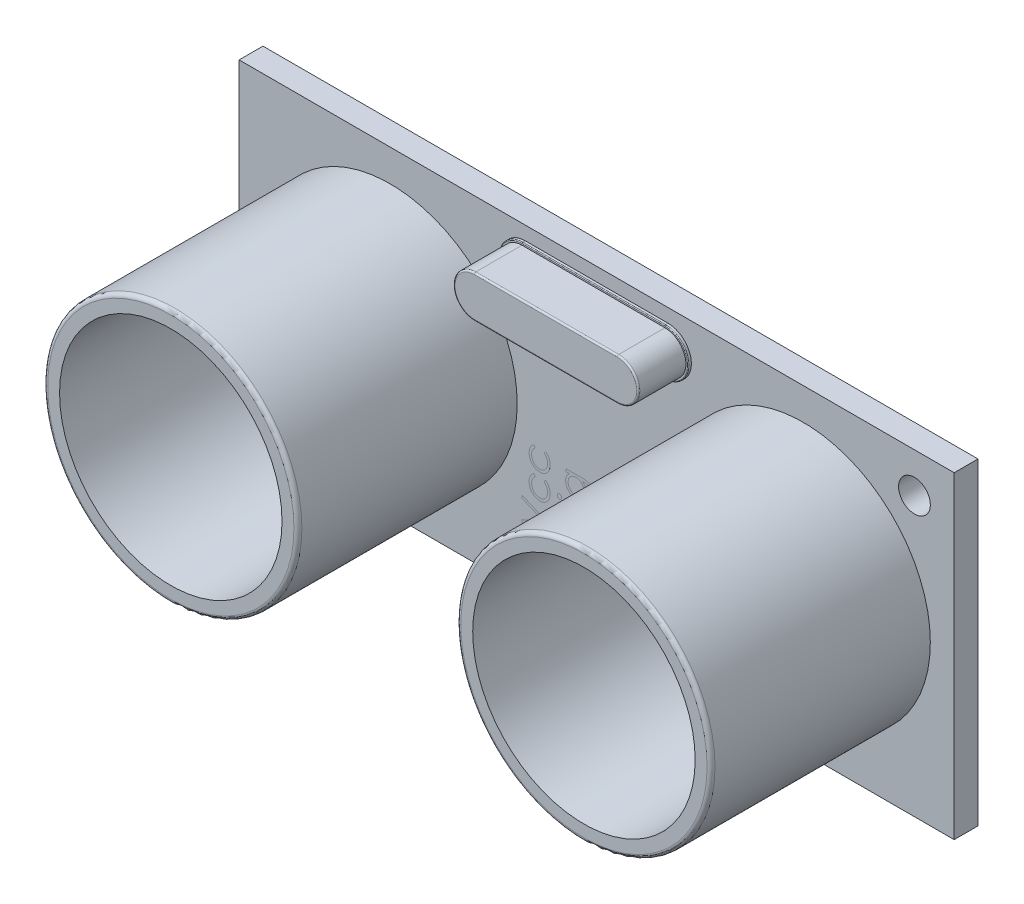
from build123d import *

# Parameters (mm, degrees)
SKETCH1_W                = 45
SKETCH1_H                = 20
SKETCH1_R                = 1
BOSS_EXTRUDE1_DEPTH      = 1.5
SKETCH2_R                = 8
BOSS_EXTRUDE2_DEPTH      = 13.8
SKETCH3_R                = 7
CUT_EXTRUDE1_DEPTH       = 11
SKETCH4_R                = 6
BOSS_EXTRUDE3_DEPTH      = 1
FILLET1_R                = 0.25
BOSS_EXTRUDE4_DEPTH      = 0.2
BOSS_EXTRUDE5_DEPTH      = 3
FILLET2_R                = 0.1
FILLET3_R                = 0.05
BOSS_EXTRUDE6_DEPTH      = 4
BOSS_EXTRUDE6_DEPTH_BACK = 2
SKETCH9_R                = 0.635
SKETCH10_W               = 1.278846153
SKETCH10_H               = 0.157051282
BOSS_EXTRUDE7_DEPTH      = 0.0001


with BuildPart() as part:
    # Sketch1 → Boss-Extrude1 (new body)
    with BuildSketch(Plane.XY):
        with Locations((22.5, 10)):
            Rectangle(SKETCH1_W, SKETCH1_H)
        with Locations((2.5, 2.5)):
            Circle(SKETCH1_R, mode=Mode.SUBTRACT)
        with Locations((42.5, 17.5)):
            Circle(SKETCH1_R, mode=Mode.SUBTRACT)
    extrude(amount=BOSS_EXTRUDE1_DEPTH)

    # Sketch2 → Boss-Extrude2 (add)
    with BuildSketch(Plane.XY.offset(1.5)):
        with Locations(Location((9.5, 10, 0), (0, 0, 180))):
            Circle(SKETCH2_R)
        with Locations(Location((35.5, 10, 0), (0, 0, 180))):
            Circle(SKETCH2_R)
    extrude(amount=BOSS_EXTRUDE2_DEPTH)

    # Sketch3 → Cut-Extrude1 (cut)
    with BuildSketch(Plane.XY.offset(15.3)):
        with Locations((9.5, 10)):
            Circle(SKETCH3_R)
        with Locations((35.5, 10)):
            Circle(SKETCH3_R)
    extrude(amount=-CUT_EXTRUDE1_DEPTH, mode=Mode.SUBTRACT)

    # Sketch4 → Boss-Extrude3 (add)
    with BuildSketch(Plane.XY.offset(4.3)):
        with Locations((9.5, 10)):
            Circle(SKETCH4_R)
        with Locations((35.5, 10)):
            Circle(SKETCH4_R)
    extrude(amount=BOSS_EXTRUDE3_DEPTH)

    # Fillet1
    fillet1_edges = [part.edges().sort_by_distance(p)[0] for p in [
        (17.5, 10, 15.3),
        (43.5, 10, 15.3),
    ]]
    fillet(fillet1_edges, radius=FILLET1_R)

    # Sketch6 → Boss-Extrude4 (add)
    with BuildSketch(Plane.XY.offset(1.5)):
        with BuildLine():
            Line((18.011775003, 19.143921077), (26.988224997, 19.143921077))
            ThreePointArc((26.988224997, 19.143921077), (28.461970519, 17.670175555), (26.988224997, 16.196430034))
            Line((26.988224997, 16.196430034), (18.011775003, 16.196430034))
            ThreePointArc((18.011775003, 16.196430034), (16.538029481, 17.670175555), (18.011775003, 19.143921077))
        make_face()
    extrude(amount=BOSS_EXTRUDE4_DEPTH)

    # Sketch7 → Boss-Extrude5 (add)
    with BuildSketch(Plane.XY.offset(1.7)):
        with BuildLine():
            Line((18.001013782, 18.998872551), (26.998986218, 18.998872551))
            ThreePointArc((26.998986218, 18.998872551), (28.318337015, 17.679521754), (26.998986218, 16.360170957))
            Line((26.998986218, 16.360170957), (18.001013782, 16.360170957))
            ThreePointArc((18.001013782, 16.360170957), (16.681662985, 17.679521754), (18.001013782, 18.998872551))
        make_face()
    extrude(amount=BOSS_EXTRUDE5_DEPTH)

    # Fillet2
    fillet2_edges = [part.edges().sort_by_distance(p)[0] for p in [
        (16.681662985, 17.679521754, 4.7),
        (22.5, 16.360170957, 4.7),
        (28.318337015, 17.679521754, 4.7),
        (22.5, 18.998872551, 4.7),
    ]]
    fillet(fillet2_edges, radius=FILLET2_R)

    # Fillet3
    fillet3_edges = [part.edges().sort_by_distance(p)[0] for p in [
        (16.538029481, 17.670175555, 1.7),
        (22.5, 16.196430034, 1.7),
        (28.461970519, 17.670175555, 1.7),
        (22.5, 19.143921077, 1.7),
    ]]
    fillet(fillet3_edges, radius=FILLET3_R)

    # Sketch9 → Boss-Extrude6 (add, two sides: drawn at the far end of the back side and taken through both)
    with BuildSketch(Plane(origin=(0, 0, 0), x_dir=(-1, 0, 0), z_dir=(0, 0, -1)).offset(-BOSS_EXTRUDE6_DEPTH_BACK)):
        with Locations((-26.31, 2.5)):
            Circle(SKETCH9_R)
        with Locations((-23.77, 2.5)):
            Circle(SKETCH9_R)
        with Locations((-21.23, 2.5)):
            Circle(SKETCH9_R)
        with Locations((-18.69, 2.5)):
            Circle(SKETCH9_R)
    extrude(amount=BOSS_EXTRUDE6_DEPTH + BOSS_EXTRUDE6_DEPTH_BACK)

    # Sketch10 → Boss-Extrude7 (add)
    # profile 1 of 15: a face of its own
    with BuildSketch(Plane.XY.offset(1.5)):
        Polygon((17.803362212, 3.675659669), (17.803362212, 3.8439289), (19.182468783, 4.427262233), (17.803362212, 5.010595566), (17.803362212, 5.178864797), (19.553362212, 4.438480182), (19.553362212, 4.416044284), align=None)
    # profile 2 of 15: a face of its own
    with BuildSketch(Plane.XY.offset(1.5)):
        with BuildLine():
            Line((18.551809728, 6.72694172), (18.633490417, 6.595481384))
            add(Edge.make_bspline(
                [(18.633490417, 6.595481384), (18.61557622, 6.581066451), (18.580315165, 6.552693103), (18.534810198, 6.503423485), (18.495726678, 6.450917778), (18.463874802, 6.394278754), (18.439264077, 6.333585854), (18.421848974, 6.269078428), (18.410996853, 6.200765676), (18.409763434, 6.153933077), (18.409131443, 6.129936512)],
                knots=[0, 0, 0, 0, 1.026593902, 2.0206758, 2.988051866, 3.946915611, 4.916868779, 5.907761954, 6.927957743, 8, 8, 8, 8], degree=3))
            add(Edge.make_bspline(
                [(18.409131443, 6.129936512), (18.409659864, 6.110757033), (18.410700575, 6.072983572), (18.417205822, 6.017530495), (18.429026826, 5.964709319), (18.444602304, 5.914188964), (18.465477449, 5.866328755), (18.490882327, 5.821003296), (18.520407347, 5.777810551), (18.55461262, 5.73800218), (18.591811954, 5.701587677), (18.631688801, 5.67003822), (18.673048747, 5.642569753), (18.716924618, 5.621016775), (18.762312645, 5.60337919), (18.810069573, 5.591775829), (18.859583576, 5.584043482), (18.893342746, 5.583158817), (18.910433526, 5.582710951)],
                knots=[0, 0, 0, 0, 1.112346261, 2.190735716, 3.231507886, 4.247384806, 5.251966152, 6.253067467, 7.256802811, 8.280671706, 9.291813951, 10.270744147, 11.225547591, 12.165006084, 13.100104208, 14.043489273, 15.009504848, 16, 16, 16, 16], degree=3))
            add(Edge.make_bspline(
                [(18.910433526, 5.582710951), (18.932814933, 5.58361406), (18.977390707, 5.585412731), (19.043078589, 5.599093018), (19.106470777, 5.621983742), (19.16722456, 5.652908049), (19.223516747, 5.692161356), (19.274009771, 5.738243731), (19.317717438, 5.791204317), (19.353953796, 5.850570195), (19.383084454, 5.914949146), (19.403838127, 5.983644176), (19.416364312, 6.056094073), (19.417942284, 6.105697445), (19.418746827, 6.130988194)],
                knots=[0, 0, 0, 0, 0.96628757, 1.924499989, 2.884001032, 3.87047137, 4.860396324, 5.839257425, 6.814467993, 7.816059692, 8.834901047, 9.858382822, 10.908076205, 12, 12, 12, 12], degree=3))
            add(Edge.make_bspline(
                [(19.418746827, 6.130988194), (19.418097079, 6.154165787), (19.41682015, 6.199715906), (19.406055669, 6.266299548), (19.388433852, 6.329689504), (19.363860027, 6.389883519), (19.332096269, 6.446771602), (19.292916684, 6.49998619), (19.247448383, 6.550586159), (19.212289398, 6.580334647), (19.194387853, 6.595481384)],
                knots=[0, 0, 0, 0, 1.039848629, 2.043578496, 3.018386758, 3.987534228, 4.954977003, 5.934852016, 6.948509513, 8, 8, 8, 8], degree=3))
            Line((19.194387853, 6.595481384), (19.280625834, 6.72694172))
            add(Edge.make_bspline(
                [(19.280625834, 6.72694172), (19.292071197, 6.719147869), (19.314923936, 6.703586036), (19.347145994, 6.677572223), (19.377306835, 6.649512307), (19.40536603, 6.619515759), (19.43199504, 6.587974254), (19.455920827, 6.553810299), (19.478488238, 6.518125493), (19.498794674, 6.480500914), (19.517047835, 6.441325565), (19.532743421, 6.40065457), (19.546228474, 6.358664664), (19.556947147, 6.315306476), (19.565502566, 6.270494527), (19.571179417, 6.22434471), (19.575417058, 6.176872919), (19.575669991, 6.144786843), (19.575798109, 6.128534268)],
                knots=[0, 0, 0, 0, 0.954134338, 1.905101784, 2.851144739, 3.791306361, 4.734911809, 5.6936923, 6.663572882, 7.643865596, 8.638447847, 9.640600242, 10.646758161, 11.676244097, 12.717260333, 13.78922464, 14.880174919, 16, 16, 16, 16], degree=3))
            add(Edge.make_bspline(
                [(19.575798109, 6.128534268), (19.575351729, 6.103729151), (19.574476821, 6.055110941), (19.564883028, 5.983945109), (19.55036629, 5.9159549), (19.529707539, 5.851020833), (19.502425286, 5.789539888), (19.469862946, 5.731000236), (19.430944426, 5.676005965), (19.386594301, 5.624917602), (19.338459422, 5.578197311), (19.286817925, 5.53754331), (19.232810939, 5.503090314), (19.176098043, 5.474709062), (19.116911787, 5.452517571), (19.054890598, 5.43723952), (18.990560693, 5.427381602), (18.946694771, 5.426238958), (18.924455962, 5.425659669)],
                knots=[0, 0, 0, 0, 1.113096611, 2.181677437, 3.217994567, 4.231807234, 5.234933164, 6.233258928, 7.234764453, 8.254006763, 9.267004511, 10.242118657, 11.199842941, 12.138404996, 13.084707599, 14.031460992, 15.002005182, 16, 16, 16, 16], degree=3))
            add(Edge.make_bspline(
                [(18.924455962, 5.425659669), (18.909366745, 5.425880177), (18.879351801, 5.426318804), (18.834804268, 5.431349768), (18.790849995, 5.437849004), (18.748046135, 5.448861873), (18.70574349, 5.461582189), (18.66445194, 5.477819954), (18.623979603, 5.496867652), (18.584430739, 5.518493626), (18.546455969, 5.542837998), (18.510579136, 5.569778615), (18.476369254, 5.598300783), (18.445007373, 5.629738839), (18.415239278, 5.662758666), (18.387860216, 5.698294454), (18.36278972, 5.736142379), (18.339564212, 5.775734041), (18.318884495, 5.817046396), (18.301067876, 5.859829732), (18.285841588, 5.903826246), (18.273787128, 5.949106318), (18.263678417, 5.995369405), (18.257319493, 6.042980074), (18.252826357, 6.091756185), (18.252330961, 6.124784196), (18.252080161, 6.141505021)],
                knots=[0, 0, 0, 0, 0.990994727, 1.971252077, 2.943264845, 3.907940874, 4.872158414, 5.844625996, 6.82015047, 7.809835459, 8.804511986, 9.781214284, 10.756496977, 11.728388426, 12.696359165, 13.676225489, 14.672885716, 15.677705647, 16.690706858, 17.706033469, 18.721040654, 19.747369689, 20.783475414, 21.830280724, 22.901553713, 24, 24, 24, 24], degree=3))
            add(Edge.make_bspline(
                [(18.252080161, 6.141505021), (18.252541059, 6.162445101), (18.25346055, 6.204220593), (18.261200585, 6.26619056), (18.272866128, 6.327249611), (18.290162436, 6.386317767), (18.311058705, 6.442710418), (18.334665582, 6.495358192), (18.361498287, 6.543466003), (18.391392543, 6.587458188), (18.425446871, 6.627322558), (18.463314643, 6.66408085), (18.505268431, 6.697975248), (18.536167928, 6.717206543), (18.551809728, 6.72694172)],
                knots=[0, 0, 0, 0, 1.095139042, 2.184804066, 3.262657822, 4.34424993, 5.400369085, 6.407210964, 7.359649996, 8.278719237, 9.185177137, 10.097389079, 11.036869154, 12, 12, 12, 12], degree=3))
        make_face()
    # profile 3 of 15: a face of its own
    with BuildSketch(Plane.XY.offset(1.5)):
        with BuildLine():
            Line((18.551809728, 8.297454541), (18.633490417, 8.165994204))
            add(Edge.make_bspline(
                [(18.633490417, 8.165994204), (18.61557622, 8.151579271), (18.580315165, 8.123205924), (18.534810198, 8.073936306), (18.495726678, 8.021430599), (18.463874802, 7.964791575), (18.439264077, 7.904098675), (18.421848974, 7.839591249), (18.410996853, 7.771278497), (18.409763434, 7.724445897), (18.409131443, 7.700449332)],
                knots=[0, 0, 0, 0, 1.026593902, 2.0206758, 2.988051866, 3.946915611, 4.916868779, 5.907761954, 6.927957743, 8, 8, 8, 8], degree=3))
            add(Edge.make_bspline(
                [(18.409131443, 7.700449332), (18.409659864, 7.681269854), (18.410700575, 7.643496393), (18.417205822, 7.588043316), (18.429026826, 7.535222139), (18.444602304, 7.484701785), (18.465477449, 7.436841576), (18.490882327, 7.391516116), (18.520407347, 7.348323371), (18.55461262, 7.308515001), (18.591811954, 7.272100497), (18.631688801, 7.24055104), (18.673048747, 7.213082573), (18.716924618, 7.191529595), (18.762312645, 7.17389201), (18.810069573, 7.16228865), (18.859583576, 7.154556302), (18.893342746, 7.153671638), (18.910433526, 7.153223771)],
                knots=[0, 0, 0, 0, 1.112346261, 2.190735716, 3.231507886, 4.247384806, 5.251966152, 6.253067467, 7.256802811, 8.280671706, 9.291813951, 10.270744147, 11.225547591, 12.165006084, 13.100104208, 14.043489273, 15.009504848, 16, 16, 16, 16], degree=3))
            add(Edge.make_bspline(
                [(18.910433526, 7.153223771), (18.932814933, 7.154126881), (18.977390707, 7.155925552), (19.043078589, 7.169605839), (19.106470777, 7.192496563), (19.16722456, 7.22342087), (19.223516747, 7.262674177), (19.274009771, 7.308756551), (19.317717438, 7.361717138), (19.353953796, 7.421083015), (19.383084454, 7.485461966), (19.403838127, 7.554156997), (19.416364312, 7.626606893), (19.417942284, 7.676210266), (19.418746827, 7.701501015)],
                knots=[0, 0, 0, 0, 0.96628757, 1.924499989, 2.884001032, 3.87047137, 4.860396324, 5.839257425, 6.814467993, 7.816059692, 8.834901047, 9.858382822, 10.908076205, 12, 12, 12, 12], degree=3))
            add(Edge.make_bspline(
                [(19.418746827, 7.701501015), (19.418097079, 7.724678607), (19.41682015, 7.770228726), (19.406055669, 7.836812369), (19.388433852, 7.900202324), (19.363860027, 7.96039634), (19.332096269, 8.017284423), (19.292916684, 8.07049901), (19.247448383, 8.121098979), (19.212289398, 8.150847468), (19.194387853, 8.165994204)],
                knots=[0, 0, 0, 0, 1.039848629, 2.043578496, 3.018386758, 3.987534228, 4.954977003, 5.934852016, 6.948509513, 8, 8, 8, 8], degree=3))
            Line((19.194387853, 8.165994204), (19.280625834, 8.297454541))
            add(Edge.make_bspline(
                [(19.280625834, 8.297454541), (19.292071197, 8.28966069), (19.314923936, 8.274098856), (19.347145994, 8.248085043), (19.377306835, 8.220025128), (19.40536603, 8.190028579), (19.43199504, 8.158487074), (19.455920827, 8.124323119), (19.478488238, 8.088638314), (19.498794674, 8.051013735), (19.517047835, 8.011838386), (19.532743421, 7.971167391), (19.546228474, 7.929177485), (19.556947147, 7.885819297), (19.565502566, 7.841007347), (19.571179417, 7.79485753), (19.575417058, 7.747385739), (19.575669991, 7.715299664), (19.575798109, 7.699047089)],
                knots=[0, 0, 0, 0, 0.954134338, 1.905101784, 2.851144739, 3.791306361, 4.734911809, 5.6936923, 6.663572882, 7.643865596, 8.638447847, 9.640600242, 10.646758161, 11.676244097, 12.717260333, 13.78922464, 14.880174919, 16, 16, 16, 16], degree=3))
            add(Edge.make_bspline(
                [(19.575798109, 7.699047089), (19.575351729, 7.674241971), (19.574476821, 7.625623761), (19.564883028, 7.554457929), (19.55036629, 7.486467721), (19.529707539, 7.421533653), (19.502425286, 7.360052708), (19.469862946, 7.301513056), (19.430944426, 7.246518786), (19.386594301, 7.195430423), (19.338459422, 7.148710132), (19.286817925, 7.108056131), (19.232810939, 7.073603135), (19.176098043, 7.045221883), (19.116911787, 7.023030392), (19.054890598, 7.00775234), (18.990560693, 6.997894423), (18.946694771, 6.996751778), (18.924455962, 6.996172489)],
                knots=[0, 0, 0, 0, 1.113096611, 2.181677437, 3.217994567, 4.231807234, 5.234933164, 6.233258928, 7.234764453, 8.254006763, 9.267004511, 10.242118657, 11.199842941, 12.138404996, 13.084707599, 14.031460992, 15.002005182, 16, 16, 16, 16], degree=3))
            add(Edge.make_bspline(
                [(18.924455962, 6.996172489), (18.909366745, 6.996392997), (18.879351801, 6.996831624), (18.834804268, 7.001862588), (18.790849995, 7.008361825), (18.748046135, 7.019374693), (18.70574349, 7.032095009), (18.66445194, 7.048332775), (18.623979603, 7.067380472), (18.584430739, 7.089006446), (18.546455969, 7.113350819), (18.510579136, 7.140291435), (18.476369254, 7.168813603), (18.445007373, 7.200251659), (18.415239278, 7.233271486), (18.387860216, 7.268807274), (18.36278972, 7.3066552), (18.339564212, 7.346246861), (18.318884495, 7.387559217), (18.301067876, 7.430342552), (18.285841588, 7.474339067), (18.273787128, 7.519619139), (18.263678417, 7.565882225), (18.257319493, 7.613492894), (18.252826357, 7.662269006), (18.252330961, 7.695297017), (18.252080161, 7.712017842)],
                knots=[0, 0, 0, 0, 0.990994727, 1.971252077, 2.943264845, 3.907940874, 4.872158414, 5.844625996, 6.82015047, 7.809835459, 8.804511986, 9.781214284, 10.756496977, 11.728388426, 12.696359165, 13.676225489, 14.672885716, 15.677705647, 16.690706858, 17.706033469, 18.721040654, 19.747369689, 20.783475414, 21.830280724, 22.901553713, 24, 24, 24, 24], degree=3))
            add(Edge.make_bspline(
                [(18.252080161, 7.712017842), (18.252541059, 7.732957922), (18.25346055, 7.774733414), (18.261200585, 7.83670338), (18.272866128, 7.897762431), (18.290162436, 7.956830587), (18.311058705, 8.013223238), (18.334665582, 8.065871013), (18.361498287, 8.113978824), (18.391392543, 8.157971009), (18.425446871, 8.197835379), (18.463314643, 8.23459367), (18.505268431, 8.268488068), (18.536167928, 8.287719364), (18.551809728, 8.297454541)],
                knots=[0, 0, 0, 0, 1.095139042, 2.184804066, 3.262657822, 4.34424993, 5.400369085, 6.407210964, 7.359649996, 8.278719237, 9.185177137, 10.097389079, 11.036869154, 12, 12, 12, 12], degree=3))
        make_face()
    # profile 4 of 15: a face of its own
    with BuildSketch(Plane.XY.offset(1.5)):
        with BuildLine():
            Line((20.57270296, 7.84575142), (20.57270296, 8.002802702))
            Line((20.57270296, 8.002802702), (21.587576758, 8.002802702))
            add(Edge.make_bspline(
                [(21.587576758, 8.002802702), (21.609195555, 8.002664181), (21.650925041, 8.002396802), (21.711264181, 8.000471316), (21.766997224, 7.996410977), (21.818378353, 7.991806637), (21.865169408, 7.985183279), (21.907510011, 7.977095095), (21.945440792, 7.967977255), (21.968803212, 7.959967147), (21.979854402, 7.956178103)],
                knots=[0, 0, 0, 0, 1.307562039, 2.523909702, 3.650326591, 4.686913197, 5.643429486, 6.506965704, 7.293745905, 8, 8, 8, 8], degree=3))
            add(Edge.make_bspline(
                [(21.979854402, 7.956178103), (21.994219329, 7.950583457), (22.022519681, 7.93956144), (22.062637325, 7.918919012), (22.100408728, 7.89580062), (22.135634097, 7.869402582), (22.168096727, 7.839812237), (22.198601989, 7.807898565), (22.226002217, 7.772541963), (22.250626505, 7.734361547), (22.27323845, 7.694128194), (22.292529917, 7.651539374), (22.308619821, 7.606823887), (22.321859021, 7.560188059), (22.332539827, 7.511634611), (22.339666213, 7.461001919), (22.34446481, 7.408461093), (22.344911985, 7.372739013), (22.345138857, 7.354615603)],
                knots=[0, 0, 0, 0, 0.98202571, 1.934689484, 2.871054655, 3.802072519, 4.735470746, 5.668036537, 6.612630213, 7.581518814, 8.561763468, 9.551722253, 10.55777311, 11.588015789, 12.63986657, 13.723744117, 14.845153492, 16, 16, 16, 16], degree=3))
            add(Edge.make_bspline(
                [(22.345138857, 7.354615603), (22.34465691, 7.328180633), (22.343715789, 7.276559865), (22.334720042, 7.201144587), (22.320209782, 7.129754574), (22.29953605, 7.062910123), (22.273971098, 7.001283776), (22.24468507, 6.945219694), (22.211087588, 6.89523467), (22.172838012, 6.850172698), (22.127355969, 6.809501941), (22.073756608, 6.771238284), (22.011223145, 6.734407817), (21.965326791, 6.712823497), (21.941292703, 6.701520651)],
                knots=[0, 0, 0, 0, 1.157856589, 2.260999188, 3.322382479, 4.345906448, 5.321474636, 6.242187631, 7.112686896, 7.955149481, 8.825136643, 9.778649332, 10.836767353, 12, 12, 12, 12], degree=3))
            Line((21.941292703, 6.701520651), (21.941292703, 6.858571933))
            add(Edge.make_bspline(
                [(21.941292703, 6.858571933), (21.961339212, 6.871208764), (22.000527669, 6.895912213), (22.051318442, 6.941955177), (22.094326364, 6.992785117), (22.12922236, 7.049480537), (22.156086519, 7.112436857), (22.174746066, 7.182061382), (22.186034985, 7.258544651), (22.187384717, 7.311806157), (22.188087575, 7.339541485)],
                knots=[0, 0, 0, 0, 0.997887113, 1.950746426, 2.877762071, 3.798308985, 4.747694893, 5.754452072, 6.830656281, 8, 8, 8, 8], degree=3))
            add(Edge.make_bspline(
                [(22.188087575, 7.339541485), (22.187375492, 7.366926136), (22.186002668, 7.419721003), (22.174741584, 7.495620455), (22.156080715, 7.565017873), (22.129277157, 7.627146787), (22.097081851, 7.681620679), (22.061474722, 7.728850817), (22.020848153, 7.766802069), (21.983477695, 7.79242582), (21.950162503, 7.808339036), (21.921488057, 7.818482173), (21.889167426, 7.826662495), (21.853123485, 7.833684706), (21.813342401, 7.839249014), (21.769688508, 7.84289976), (21.72245707, 7.845490879), (21.689710765, 7.845662565), (21.672763056, 7.84575142)],
                knots=[0, 0, 0, 0, 1.570880491, 3.028500349, 4.391799536, 5.683507043, 6.897971719, 8.016608159, 9.065046722, 10.074948333, 10.602832593, 11.179761774, 11.817338097, 12.514350094, 13.286299219, 14.121078732, 15.027572402, 16, 16, 16, 16], degree=3))
            Line((21.672763056, 7.84575142), (21.606507046, 7.84575142))
            add(Edge.make_bspline(
                [(21.606507046, 7.84575142), (21.625470248, 7.829805493), (21.663063094, 7.798194123), (21.712411228, 7.743749253), (21.754398696, 7.683906414), (21.789323862, 7.619511506), (21.816994681, 7.55152423), (21.837044604, 7.481146606), (21.849481012, 7.408576213), (21.850854857, 7.35945596), (21.851549113, 7.334633632)],
                knots=[0, 0, 0, 0, 1.012670515, 2.007528466, 2.995541538, 3.996581493, 4.997861088, 5.991949332, 6.98525577, 8, 8, 8, 8], degree=3))
            add(Edge.make_bspline(
                [(21.851549113, 7.334633632), (21.851240681, 7.320021048), (21.850627694, 7.290979683), (21.846898859, 7.247712794), (21.839637559, 7.205279766), (21.83033943, 7.163410297), (21.817875548, 7.122396899), (21.803246936, 7.081748156), (21.785279131, 7.042054383), (21.765049849, 7.003113049), (21.742320844, 6.965840323), (21.717763951, 6.930353395), (21.691431517, 6.896870524), (21.663083917, 6.86570191), (21.632756921, 6.836890672), (21.600775206, 6.810048712), (21.566691818, 6.785620045), (21.531128344, 6.763103349), (21.493847881, 6.743574574), (21.455658834, 6.726432388), (21.416642856, 6.711527685), (21.376669325, 6.699644984), (21.335763441, 6.690569428), (21.293992216, 6.683814314), (21.251227022, 6.679982849), (21.222416348, 6.679385386), (21.207919306, 6.679084754)],
                knots=[0, 0, 0, 0, 1.028710361, 2.044481286, 3.053267669, 4.056977562, 5.061496029, 6.068537106, 7.095799505, 8.125955792, 9.155750787, 10.166547241, 11.162135275, 12.151998358, 13.129411568, 14.10464185, 15.088574784, 16.079052837, 17.065149435, 18.048153627, 19.024354702, 20.002874835, 20.980703288, 21.971932454, 22.97951087, 24, 24, 24, 24], degree=3))
            add(Edge.make_bspline(
                [(21.207919306, 6.679084754), (21.193417758, 6.679344337), (21.164470828, 6.679862498), (21.121531136, 6.684337987), (21.079166418, 6.690722082), (21.037813347, 6.700825967), (20.997000971, 6.712987228), (20.957030743, 6.728049014), (20.917890489, 6.746158394), (20.879551223, 6.766663269), (20.842527415, 6.789705315), (20.807364092, 6.814971555), (20.774320006, 6.842492493), (20.743061796, 6.87188845), (20.713891049, 6.903518359), (20.686878566, 6.937365855), (20.661571553, 6.973097295), (20.638515885, 7.01082342), (20.618124762, 7.049962114), (20.599518463, 7.089519023), (20.584751403, 7.130018141), (20.571739854, 7.170704411), (20.562522256, 7.212294368), (20.555411135, 7.254278065), (20.551078775, 7.296799234), (20.550537982, 7.325275681), (20.550267062, 7.339541485)],
                knots=[0, 0, 0, 0, 1.008818848, 2.013730394, 3.001654427, 3.987803273, 4.973046549, 5.963777569, 6.957074694, 7.972068341, 8.987420212, 9.989399531, 10.982630087, 11.977756091, 12.973280677, 13.973972381, 14.989194003, 16.018387222, 17.047741039, 18.059210846, 19.057554164, 20.045176975, 21.029480261, 22.018708529, 23.007435371, 24, 24, 24, 24], degree=3))
            add(Edge.make_bspline(
                [(20.550267062, 7.339541485), (20.550945399, 7.363066954), (20.552284905, 7.409522528), (20.562795478, 7.477888029), (20.579552485, 7.543859149), (20.6035603, 7.607808157), (20.636335319, 7.670255982), (20.679506793, 7.73099681), (20.733461963, 7.790206377), (20.774838395, 7.826745292), (20.796360812, 7.84575142)],
                knots=[0, 0, 0, 0, 0.96728863, 1.910097829, 2.838038873, 3.762875196, 4.71315279, 5.730631239, 6.819562287, 8, 8, 8, 8], degree=3))
            Line((20.796360812, 7.84575142), (20.57270296, 7.84575142))
        make_face()
        with BuildLine():
            add(Edge.make_bspline(
                [(20.707318344, 7.352161677), (20.708101741, 7.329197785), (20.709652702, 7.28373415), (20.722803331, 7.217068703), (20.743618036, 7.152858408), (20.772589667, 7.091736388), (20.809204665, 7.035110656), (20.852766922, 6.984435203), (20.902678809, 6.940253363), (20.958297343, 6.902869012), (21.018394994, 6.873004562), (21.081713243, 6.852142994), (21.147146027, 6.838353737), (21.191723564, 6.836880053), (21.214229402, 6.836136036)],
                knots=[0, 0, 0, 0, 1.026191648, 2.031641866, 3.026511193, 4.038688626, 5.047555432, 6.033268986, 7.01798463, 8.019529538, 9.022150945, 10.008736843, 10.994672018, 12, 12, 12, 12], degree=3))
            add(Edge.make_bspline(
                [(21.214229402, 6.836136036), (21.231195488, 6.836500372), (21.264562819, 6.837216915), (21.313539604, 6.844057919), (21.360258588, 6.855249872), (21.4046754, 6.870712637), (21.446795701, 6.890471022), (21.486616551, 6.914840735), (21.524160239, 6.943685686), (21.559109959, 6.976609509), (21.590939799, 7.012899148), (21.618908991, 7.052258362), (21.641784306, 7.09463609), (21.661554737, 7.138989467), (21.675994267, 7.186394852), (21.687013658, 7.236169393), (21.693318036, 7.288665242), (21.694099435, 7.324451112), (21.694497831, 7.342696533)],
                knots=[0, 0, 0, 0, 1.039710933, 2.044807362, 3.024849673, 3.981007225, 4.923240656, 5.871799057, 6.837597342, 7.820855272, 8.810901995, 9.792827897, 10.773995565, 11.758948565, 12.765014796, 13.806304263, 14.881544521, 16, 16, 16, 16], degree=3))
            add(Edge.make_bspline(
                [(21.694497831, 7.342696533), (21.694114027, 7.361178412), (21.693363501, 7.39731953), (21.686911752, 7.450104999), (21.676500764, 7.500121369), (21.661719251, 7.54732278), (21.642858376, 7.591887451), (21.618990067, 7.633314758), (21.591807851, 7.672492982), (21.560101844, 7.708171187), (21.525159346, 7.740433269), (21.487136899, 7.768548653), (21.446606639, 7.792505877), (21.403573137, 7.812344712), (21.35770196, 7.827490314), (21.309107782, 7.837649767), (21.258023413, 7.844753139), (21.223019105, 7.845413602), (21.205114819, 7.84575142)],
                knots=[0, 0, 0, 0, 1.121943988, 2.193949579, 3.223793937, 4.220241907, 5.192961521, 6.155822191, 7.11847367, 8.083710714, 9.04790392, 10.001595906, 10.949595423, 11.902125208, 12.873731292, 13.87582262, 14.913508608, 16, 16, 16, 16], degree=3))
            add(Edge.make_bspline(
                [(21.205114819, 7.84575142), (21.181806387, 7.845080435), (21.136269903, 7.843769564), (21.069909566, 7.831437848), (21.007450017, 7.811433721), (20.949051075, 7.783671197), (20.895526158, 7.748721502), (20.848230657, 7.706213699), (20.805860205, 7.658028717), (20.771021731, 7.602988185), (20.74262444, 7.544075719), (20.722011132, 7.482160187), (20.709876348, 7.417840544), (20.70817592, 7.374180634), (20.707318344, 7.352161677)],
                knots=[0, 0, 0, 0, 1.070678282, 2.091729125, 3.090678259, 4.078281522, 5.055707048, 6.018451281, 6.993304669, 7.996175111, 9.002951586, 9.993356152, 10.987991402, 12, 12, 12, 12], degree=3))
        make_face(mode=Mode.SUBTRACT)
    # profile 5 of 15: a face of its own
    with BuildSketch(Plane.XY.offset(1.5)):
        with BuildLine():
            add(Edge.make_bspline(
                [(20.034241421, 6.285755427), (20.034693497, 6.295501085), (20.035578749, 6.314584955), (20.043159488, 6.342181588), (20.056009331, 6.367310095), (20.073249171, 6.389598961), (20.093523893, 6.408724904), (20.117154377, 6.422115259), (20.142683696, 6.430721458), (20.160491241, 6.431760735), (20.169557928, 6.432289882)],
                knots=[0, 0, 0, 0, 1.055194115, 2.066272739, 3.074728998, 4.095836921, 5.109056067, 6.073838105, 7.019297344, 8, 8, 8, 8], degree=3))
            add(Edge.make_bspline(
                [(20.169557928, 6.432289882), (20.178389254, 6.431748802), (20.195847742, 6.430679151), (20.220934478, 6.422121907), (20.244236619, 6.408610788), (20.264471975, 6.389611225), (20.281702285, 6.367306845), (20.294554654, 6.342182452), (20.302134723, 6.314584728), (20.303020067, 6.295501008), (20.30347219, 6.285755427)],
                knots=[0, 0, 0, 0, 0.96129708, 1.900370562, 2.859976407, 3.87933698, 4.906634145, 5.921202961, 6.938410037, 8, 8, 8, 8], degree=3))
            add(Edge.make_bspline(
                [(20.30347219, 6.285755427), (20.30303733, 6.276121289), (20.302190932, 6.257369699), (20.294405923, 6.230186278), (20.281697886, 6.205272033), (20.264584794, 6.182939697), (20.244112345, 6.1643246), (20.220948698, 6.150775438), (20.195844121, 6.142237957), (20.178388038, 6.141165642), (20.169557928, 6.140623215)],
                knots=[0, 0, 0, 0, 1.054934014, 2.053291228, 3.073705704, 4.106921865, 5.123545215, 6.088680038, 7.033164197, 8, 8, 8, 8], degree=3))
            add(Edge.make_bspline(
                [(20.169557928, 6.140623215), (20.160492503, 6.141153759), (20.142687436, 6.142195779), (20.11713992, 6.150781837), (20.093649169, 6.164211741), (20.073136419, 6.182952023), (20.056013702, 6.205268753), (20.043308211, 6.230187126), (20.035522542, 6.257369475), (20.034676234, 6.276121213), (20.034241421, 6.285755427)],
                knots=[0, 0, 0, 0, 0.98631895, 1.937192651, 2.907499808, 3.917963147, 4.944918757, 5.95915025, 6.951458133, 8, 8, 8, 8], degree=3))
        make_face()
    # profile 6 of 15: a face of its own
    with BuildSketch(Plane.XY.offset(1.5)):
        with Locations((21.212126037, 6.286456549)):
            Rectangle(SKETCH10_W, SKETCH10_H)
    # profile 7 of 15: a face of its own
    with BuildSketch(Plane.XY.offset(1.5)):
        with BuildLine():
            Line((20.57270296, 5.445110395), (20.57270296, 5.602161677))
            Line((20.57270296, 5.602161677), (20.760954162, 5.602161677))
            add(Edge.make_bspline(
                [(20.760954162, 5.602161677), (20.743418401, 5.613748638), (20.709881394, 5.63590861), (20.665586085, 5.672913519), (20.628492507, 5.710413306), (20.599308043, 5.749392647), (20.577251714, 5.789469379), (20.561753423, 5.830305558), (20.552142461, 5.872001041), (20.550893033, 5.900088772), (20.550267062, 5.914160876)],
                knots=[0, 0, 0, 0, 1.280091057, 2.448164201, 3.510831157, 4.48793739, 5.405868014, 6.289422536, 7.142991551, 8, 8, 8, 8], degree=3))
            add(Edge.make_bspline(
                [(20.550267062, 5.914160876), (20.550862325, 5.925074039), (20.552087118, 5.947528581), (20.560692531, 5.981519876), (20.574431542, 6.016541602), (20.587351653, 6.039112796), (20.594087174, 6.050879626)],
                knots=[0, 0, 0, 0, 0.901110191, 1.854092781, 2.881294221, 4, 4, 4, 4], degree=3))
            Line((20.594087174, 6.050879626), (20.730104803, 5.964641645))
            add(Edge.make_bspline(
                [(20.730104803, 5.964641645), (20.72673467, 5.957087134), (20.720337512, 5.942747227), (20.712766507, 5.921769944), (20.708308549, 5.902429275), (20.70763319, 5.890107496), (20.707318344, 5.884363199)],
                knots=[0, 0, 0, 0, 1.180555205, 2.24091978, 3.179933427, 4, 4, 4, 4], degree=3))
            add(Edge.make_bspline(
                [(20.707318344, 5.884363199), (20.708151785, 5.871756549), (20.709851761, 5.846042636), (20.723407094, 5.808416969), (20.744678503, 5.771579281), (20.768900349, 5.742605164), (20.792167551, 5.720091732), (20.812531483, 5.703900643), (20.835576885, 5.6893689), (20.860413001, 5.675272722), (20.887663147, 5.66217631), (20.917371778, 5.650472741), (20.949293571, 5.639527651), (20.971489538, 5.633363881), (20.98285921, 5.630206549)],
                knots=[0, 0, 0, 0, 1.125322384, 2.295331465, 3.535939348, 4.916963136, 5.656144286, 6.429838446, 7.238666481, 8.090384391, 8.983239461, 9.940052224, 10.944811494, 12, 12, 12, 12], degree=3))
            add(Edge.make_bspline(
                [(20.98285921, 5.630206549), (20.992997235, 5.627836263), (21.015564797, 5.622559932), (21.053253496, 5.617566736), (21.09775281, 5.612434544), (21.149114432, 5.608929773), (21.207535798, 5.605619051), (21.272764878, 5.603790071), (21.344980954, 5.602219869), (21.395351384, 5.602181693), (21.421761453, 5.602161677)],
                knots=[0, 0, 0, 0, 0.566841273, 1.261806378, 2.068780918, 3.007109044, 4.065315289, 5.256255371, 6.561408263, 8, 8, 8, 8], degree=3))
            Line((21.421761453, 5.602161677), (21.851549113, 5.602161677))
            Line((21.851549113, 5.602161677), (21.851549113, 5.445110395))
            Line((21.851549113, 5.445110395), (20.57270296, 5.445110395))
        make_face()
    # profile 8 of 15: a face of its own
    with BuildSketch(Plane.XY.offset(1.5)):
        Polygon((20.281036293, 4.300879626), (20.101549113, 4.300879626), (20.101549113, 5.22075142), (20.281036293, 5.22075142), (20.281036293, 4.839341164), (21.851549113, 4.839341164), (21.851549113, 4.682289882), (20.281036293, 4.682289882), align=None)
    # profile 9 of 15: a face of its own
    with BuildSketch(Plane.XY.offset(1.5)):
        with BuildLine():
            add(Edge.make_bspline(
                [(23.193181999, 7.565653263), (23.193704181, 7.584750071), (23.194733908, 7.622408425), (23.205438499, 7.677482811), (23.22193742, 7.730085266), (23.244706536, 7.780416074), (23.275171531, 7.827575277), (23.3113342, 7.872704757), (23.354477306, 7.91510776), (23.387109367, 7.940157554), (23.403869098, 7.953023055)],
                knots=[0, 0, 0, 0, 0.997600737, 1.967239891, 2.921995117, 3.876339565, 4.846055743, 5.850055787, 6.895794904, 8, 8, 8, 8], degree=3))
            add(Edge.make_bspline(
                [(23.403869098, 7.953023055), (23.420041746, 7.964188962), (23.452364412, 7.986505152), (23.50410136, 8.014556224), (23.557594266, 8.039127531), (23.613585541, 8.05876207), (23.671809159, 8.073689147), (23.732139049, 8.084565922), (23.794583447, 8.091469408), (23.837027345, 8.092183994), (23.858546582, 8.092546292)],
                knots=[0, 0, 0, 0, 0.974492422, 1.947621278, 2.915467704, 3.892853539, 4.88708504, 5.894700399, 6.932604111, 8, 8, 8, 8], degree=3))
            add(Edge.make_bspline(
                [(23.858546582, 8.092546292), (23.880179302, 8.092021842), (23.92284567, 8.090987467), (23.985835599, 8.084376517), (24.046752133, 8.072669113), (24.105647108, 8.056652946), (24.162561377, 8.035845607), (24.217107328, 8.010193183), (24.269830451, 7.980200054), (24.319701506, 7.945883274), (24.36577335, 7.908198926), (24.406138959, 7.867227539), (24.440521312, 7.823636454), (24.468291842, 7.77698321), (24.490317434, 7.727991254), (24.505799414, 7.676267276), (24.515086201, 7.621844628), (24.51628773, 7.584620262), (24.516899948, 7.565653263)],
                knots=[0, 0, 0, 0, 1.107894965, 2.185109244, 3.239066719, 4.281441704, 5.307577007, 6.338291467, 7.364845487, 8.410599108, 9.435040353, 10.408337498, 11.35046711, 12.27106388, 13.181883432, 14.094411748, 15.029042138, 16, 16, 16, 16], degree=3))
            add(Edge.make_bspline(
                [(24.516899948, 7.565653263), (24.516291333, 7.546685175), (24.515096875, 7.509458672), (24.505739984, 7.454940824), (24.490395236, 7.403056912), (24.468279289, 7.353979369), (24.440539924, 7.307302887), (24.406022956, 7.263724921), (24.365904161, 7.22239507), (24.319683026, 7.184740136), (24.269835343, 7.150400584), (24.217106021, 7.120413495), (24.162561726, 7.094759458), (24.105647013, 7.073952551), (24.046752159, 7.057936267), (23.985835592, 7.046228894), (23.922845672, 7.039617937), (23.880179302, 7.038583562), (23.858546582, 7.038059113)],
                knots=[0, 0, 0, 0, 0.97035087, 1.904396978, 2.822082662, 3.732332818, 4.652354079, 5.593894721, 6.570857939, 7.594658757, 8.639758628, 9.6656709, 10.695741012, 11.721234828, 12.762958176, 13.816256772, 14.892797633, 16, 16, 16, 16], degree=3))
            add(Edge.make_bspline(
                [(23.858546582, 7.038059113), (23.837142943, 7.038419827), (23.794813443, 7.039133203), (23.73250604, 7.046100112), (23.672293897, 7.056663327), (23.614566631, 7.072520715), (23.558489248, 7.091433959), (23.504951817, 7.115897193), (23.453360037, 7.144207205), (23.421102833, 7.16643275), (23.404920781, 7.17758235)],
                knots=[0, 0, 0, 0, 1.063892623, 2.1040368, 3.113827242, 4.100449227, 5.078030009, 6.053259504, 7.023403995, 8, 8, 8, 8], degree=3))
            add(Edge.make_bspline(
                [(23.404920781, 7.17758235), (23.38801992, 7.190422493), (23.355181994, 7.215370553), (23.312098455, 7.25804371), (23.275337445, 7.302933769), (23.24526099, 7.350595476), (23.221827512, 7.400761853), (23.205472212, 7.453489914), (23.194702785, 7.508658343), (23.193694728, 7.546437578), (23.193181999, 7.565653263)],
                knots=[0, 0, 0, 0, 1.105877608, 2.148691041, 3.153713737, 4.125868282, 5.080095171, 6.03217926, 6.999105637, 8, 8, 8, 8], degree=3))
        make_face()
        with BuildLine():
            add(Edge.make_bspline(
                [(23.350233281, 7.565302702), (23.350716884, 7.552066116), (23.351673852, 7.525873177), (23.358958637, 7.487375081), (23.37048033, 7.450371551), (23.38689368, 7.414808049), (23.408107934, 7.380789595), (23.43378656, 7.348049792), (23.464429059, 7.317025521), (23.499000431, 7.287656572), (23.537024717, 7.260800679), (23.577435985, 7.237363344), (23.619637446, 7.217068445), (23.664065356, 7.201274009), (23.71005711, 7.187806043), (23.758301306, 7.179589163), (23.808260978, 7.173488968), (23.842283719, 7.172949194), (23.859598265, 7.172674497)],
                knots=[0, 0, 0, 0, 0.892062397, 1.765238749, 2.632457948, 3.499748733, 4.398432829, 5.329985934, 6.299486433, 7.333591616, 8.385110458, 9.433791507, 10.480546765, 11.537424675, 12.60998767, 13.707271034, 14.833205124, 16, 16, 16, 16], degree=3))
            add(Edge.make_bspline(
                [(23.859598265, 7.172674497), (23.881962743, 7.173191279), (23.926229381, 7.17421416), (23.991205766, 7.185074632), (24.054147876, 7.200800443), (24.113661668, 7.223994466), (24.168816506, 7.252494447), (24.218475737, 7.285639203), (24.26080712, 7.32429381), (24.296620112, 7.366789517), (24.324628682, 7.412996667), (24.344897266, 7.46178497), (24.357865673, 7.51274733), (24.359184414, 7.547698004), (24.359848665, 7.565302702)],
                knots=[0, 0, 0, 0, 1.139368929, 2.255184748, 3.350673064, 4.442866719, 5.503577089, 6.511720108, 7.47770502, 8.416871705, 9.336594054, 10.220769263, 11.103799257, 12, 12, 12, 12], degree=3))
            add(Edge.make_bspline(
                [(24.359848665, 7.565302702), (24.359186184, 7.582908597), (24.357870956, 7.617861647), (24.344876482, 7.668806383), (24.324746312, 7.71756987), (24.296373047, 7.763514583), (24.261065584, 7.806321517), (24.218324305, 7.844572808), (24.16883946, 7.877778119), (24.113662766, 7.906284376), (24.054090728, 7.929346758), (23.991266068, 7.945646357), (23.926221359, 7.956360168), (23.881960051, 7.957403695), (23.859598265, 7.957930908)],
                knots=[0, 0, 0, 0, 0.896424748, 1.779675456, 2.664071664, 3.578931997, 4.522916774, 5.48514584, 6.493540845, 7.554516339, 8.646982988, 9.744251569, 10.860346286, 12, 12, 12, 12], degree=3))
            add(Edge.make_bspline(
                [(23.859598265, 7.957930908), (23.842286921, 7.957641224), (23.808270472, 7.957072002), (23.758243994, 7.951182442), (23.710176245, 7.942187006), (23.663917369, 7.929570992), (23.619721474, 7.913058068), (23.577437874, 7.892909896), (23.536910858, 7.869492395), (23.499110115, 7.842210172), (23.464420332, 7.812895655), (23.433769547, 7.781861385), (23.408241121, 7.749152101), (23.386681765, 7.715325963), (23.370658851, 7.679692732), (23.358878492, 7.642791568), (23.351711781, 7.60449122), (23.350728171, 7.578420047), (23.350233281, 7.565302702)],
                knots=[0, 0, 0, 0, 1.167399275, 2.293916598, 3.393210906, 4.464213596, 5.524368342, 6.571665819, 7.620890084, 8.677521736, 9.712162585, 10.682165285, 11.614200933, 12.506655785, 13.381563964, 14.241714977, 15.115343634, 16, 16, 16, 16], degree=3))
        make_face(mode=Mode.SUBTRACT)
    # profile 10 of 15: a face of its own
    with BuildSketch(Plane.XY.offset(1.5)):
        with BuildLine():
            Line((22.699592255, 6.075559113), (22.699592255, 6.210174497))
            Line((22.699592255, 6.210174497), (23.457154355, 6.210174497))
            add(Edge.make_bspline(
                [(23.457154355, 6.210174497), (23.436227615, 6.222294952), (23.396116004, 6.245526997), (23.342178635, 6.285090189), (23.296135943, 6.325993379), (23.258342015, 6.369009832), (23.22912084, 6.414226862), (23.208486238, 6.461575431), (23.195673986, 6.510751336), (23.194012978, 6.544301361), (23.193181999, 6.561085956)],
                knots=[0, 0, 0, 0, 1.256450509, 2.408318517, 3.470791238, 4.452588315, 5.376044572, 6.257483332, 7.128243973, 8, 8, 8, 8], degree=3))
            add(Edge.make_bspline(
                [(23.193181999, 6.561085956), (23.194024282, 6.578127705), (23.195690691, 6.611843797), (23.210081544, 6.66059004), (23.232906245, 6.706337737), (23.264780757, 6.74834198), (23.304302189, 6.786046065), (23.350009354, 6.819308379), (23.402479171, 6.846171236), (23.450471879, 6.864644249), (23.4934777, 6.87656556), (23.530462854, 6.884508376), (23.571766349, 6.891161371), (23.617408289, 6.896241322), (23.667328075, 6.900366678), (23.721557691, 6.903598635), (23.780011121, 6.90521162), (23.820451516, 6.905525148), (23.841369098, 6.905687318)],
                knots=[0, 0, 0, 0, 0.996285565, 1.971092021, 2.950451992, 3.976974868, 5.041747374, 6.139609738, 7.275257294, 8.483941667, 9.144789992, 9.887079528, 10.698256355, 11.59381218, 12.575870282, 13.631565315, 14.774939573, 16, 16, 16, 16], degree=3))
            Line((23.841369098, 6.905687318), (24.49446405, 6.905687318))
            Line((24.49446405, 6.905687318), (24.49446405, 6.771071933))
            Line((24.49446405, 6.771071933), (23.89290155, 6.771071933))
            add(Edge.make_bspline(
                [(23.89290155, 6.771071933), (23.875490622, 6.770938213), (23.842187769, 6.770682438), (23.794504048, 6.770581294), (23.751385108, 6.769418385), (23.712701017, 6.768076862), (23.678576188, 6.766331812), (23.648859895, 6.76440267), (23.62386388, 6.761571316), (23.608709503, 6.759415375), (23.601936005, 6.758451741)],
                knots=[0, 0, 0, 0, 1.43367231, 2.74226502, 3.926091632, 4.985183127, 5.929340614, 6.739626384, 7.436655246, 8, 8, 8, 8], degree=3))
            add(Edge.make_bspline(
                [(23.601936005, 6.758451741), (23.58218297, 6.754608763), (23.544818118, 6.747339385), (23.493346192, 6.729598725), (23.449263331, 6.707873084), (23.413156682, 6.680872691), (23.384474726, 6.649605134), (23.364555679, 6.613154092), (23.352144549, 6.57239951), (23.350883247, 6.543649577), (23.350233281, 6.528834353)],
                knots=[0, 0, 0, 0, 1.286084608, 2.432758329, 3.472581308, 4.417561404, 5.301671356, 6.1650556, 7.054428626, 8, 8, 8, 8], degree=3))
            add(Edge.make_bspline(
                [(23.350233281, 6.528834353), (23.35047266, 6.520050106), (23.350948363, 6.502593666), (23.355708043, 6.476802711), (23.363436754, 6.451722418), (23.374454153, 6.427450696), (23.388362564, 6.403853397), (23.404685477, 6.380468224), (23.425005875, 6.358561682), (23.455480114, 6.329936533), (23.498658886, 6.297638586), (23.55679818, 6.266511003), (23.620427743, 6.241709496), (23.665678298, 6.231985987), (23.688875108, 6.22700142)],
                knots=[0, 0, 0, 0, 0.644873554, 1.28152083, 1.91972944, 2.569216412, 3.234847739, 3.93053473, 4.660000565, 5.425369442, 7.001780425, 8.603889908, 10.259050789, 12, 12, 12, 12], degree=3))
            add(Edge.make_bspline(
                [(23.688875108, 6.22700142), (23.697397303, 6.225659096), (23.716028834, 6.222724457), (23.746545754, 6.219276469), (23.782103222, 6.216645821), (23.822530599, 6.214104534), (23.868005423, 6.212538661), (23.918249572, 6.211017421), (23.973529566, 6.210462732), (24.011975466, 6.21027345), (24.032074226, 6.210174497)],
                knots=[0, 0, 0, 0, 0.601974854, 1.316059127, 2.1422104, 3.089815509, 4.142494093, 5.317148409, 6.597457965, 8, 8, 8, 8], degree=3))
            Line((24.032074226, 6.210174497), (24.49446405, 6.210174497))
            Line((24.49446405, 6.210174497), (24.49446405, 6.075559113))
            Line((24.49446405, 6.075559113), (22.699592255, 6.075559113))
        make_face()
    # profile 11 of 15: a face of its own
    with BuildSketch(Plane.XY.offset(1.5)):
        with BuildLine():
            Line((23.492911566, 5.92075142), (23.574592255, 5.818387638))
            add(Edge.make_bspline(
                [(23.574592255, 5.818387638), (23.556806292, 5.807073181), (23.522346119, 5.785151503), (23.476216439, 5.746999027), (23.437574619, 5.70546688), (23.405271425, 5.661213078), (23.380655753, 5.613504533), (23.362968179, 5.56278206), (23.35213563, 5.50895001), (23.350875866, 5.471967415), (23.350233281, 5.453103183)],
                knots=[0, 0, 0, 0, 1.12284337, 2.175500681, 3.180265739, 4.139623535, 5.086772676, 6.030310645, 6.995292857, 8, 8, 8, 8], degree=3))
            add(Edge.make_bspline(
                [(23.350233281, 5.453103183), (23.350759187, 5.438008596), (23.351795765, 5.408256705), (23.358373125, 5.364542004), (23.370169329, 5.323017494), (23.385938165, 5.283240612), (23.406773529, 5.245623298), (23.432351186, 5.210135358), (23.461850122, 5.176103654), (23.496186986, 5.145058137), (23.533356398, 5.116377565), (23.573097512, 5.091497466), (23.614696021, 5.070252877), (23.658282343, 5.053129894), (23.703784565, 5.03966066), (23.751336648, 5.030429478), (23.800767084, 5.024090482), (23.83445419, 5.023576261), (23.851535364, 5.023315523)],
                knots=[0, 0, 0, 0, 0.984800101, 1.941070887, 2.875085472, 3.795184957, 4.726614095, 5.672129624, 6.6445194, 7.658794156, 8.686415767, 9.703722399, 10.712827818, 11.729191533, 12.754322074, 13.803792861, 14.886404932, 16, 16, 16, 16], degree=3))
            add(Edge.make_bspline(
                [(23.851535364, 5.023315523), (23.873894937, 5.023982041), (23.918279992, 5.025305117), (23.983678577, 5.03611546), (24.047008349, 5.053807422), (24.107559072, 5.078039599), (24.163848301, 5.108713602), (24.214298366, 5.144810369), (24.25819167, 5.186278516), (24.294491583, 5.2330188), (24.323995673, 5.283568278), (24.344751391, 5.33778487), (24.357441845, 5.39490968), (24.35903896, 5.433990912), (24.359848665, 5.453804305)],
                knots=[0, 0, 0, 0, 1.084786785, 2.153364978, 3.207470413, 4.271221031, 5.311873954, 6.311421235, 7.274248805, 8.231833337, 9.174520824, 10.104583037, 11.039061984, 12, 12, 12, 12], degree=3))
            add(Edge.make_bspline(
                [(24.359848665, 5.453804305), (24.359205504, 5.472086889), (24.357941029, 5.50803099), (24.347003331, 5.560551106), (24.329378692, 5.610467448), (24.30461107, 5.65781246), (24.272579294, 5.702358084), (24.233570534, 5.744183753), (24.187854661, 5.783786572), (24.153300327, 5.80661895), (24.135489691, 5.818387638)],
                knots=[0, 0, 0, 0, 0.977666804, 1.922121929, 2.857776524, 3.803307856, 4.771728806, 5.785246748, 6.858430813, 8, 8, 8, 8], degree=3))
            Line((24.135489691, 5.818387638), (24.221727672, 5.92075142))
            add(Edge.make_bspline(
                [(24.221727672, 5.92075142), (24.244215226, 5.908284825), (24.28834802, 5.883818595), (24.346744037, 5.837022473), (24.397924568, 5.784858095), (24.433696851, 5.736091517), (24.458014628, 5.694572023), (24.47383189, 5.662227821), (24.487194093, 5.628833332), (24.498062689, 5.59437957), (24.5065799, 5.558771669), (24.512266238, 5.522063784), (24.516515872, 5.484401416), (24.516770954, 5.458958321), (24.516899948, 5.446091965)],
                knots=[0, 0, 0, 0, 1.567329121, 3.075950915, 4.549120167, 6.018830458, 6.754204875, 7.484857737, 8.214813678, 8.948108804, 9.688724632, 10.447567985, 11.214948429, 12, 12, 12, 12], degree=3))
            add(Edge.make_bspline(
                [(24.516899948, 5.446091965), (24.516456544, 5.42641853), (24.515585796, 5.387784206), (24.505861065, 5.331199571), (24.491500816, 5.277097221), (24.470451496, 5.225554521), (24.443339755, 5.176840906), (24.410430268, 5.130514084), (24.371552871, 5.086896364), (24.327307542, 5.046265979), (24.278869545, 5.009455929), (24.227565081, 4.976795731), (24.173271235, 4.950106646), (24.116884997, 4.927083944), (24.057516418, 4.910379641), (23.995847605, 4.897437894), (23.931524711, 4.890096141), (23.887777698, 4.889170359), (23.8655578, 4.888700138)],
                knots=[0, 0, 0, 0, 0.987436768, 1.939109881, 2.876257238, 3.795318345, 4.728226445, 5.671422934, 6.644584451, 7.658373109, 8.684647591, 9.697790058, 10.708633505, 11.720346085, 12.753399259, 13.802329042, 14.88376325, 16, 16, 16, 16], degree=3))
            add(Edge.make_bspline(
                [(23.8655578, 4.888700138), (23.835584586, 4.889516952), (23.776352844, 4.891131102), (23.689263711, 4.905771567), (23.605366972, 4.928737956), (23.53867756, 4.955913624), (23.487690916, 4.981234559), (23.451970321, 5.00299841), (23.417835738, 5.0254862), (23.386193545, 5.050229747), (23.356650275, 5.076545964), (23.329238586, 5.104660377), (23.303937248, 5.134531569), (23.280833059, 5.16602318), (23.26012682, 5.198901605), (23.242294555, 5.232932832), (23.227027675, 5.267800579), (23.214891827, 5.303747538), (23.204782949, 5.340546234), (23.198467435, 5.378505015), (23.193927011, 5.417236703), (23.193432119, 5.443390533), (23.193181999, 5.456608792)],
                knots=[0, 0, 0, 0, 1.832988054, 3.622270117, 5.388410994, 7.146542647, 8.019596399, 8.869470614, 9.704442917, 10.519770436, 11.325032381, 12.124014951, 12.920593885, 13.718679943, 14.512300476, 15.295968143, 16.067801222, 16.838938343, 17.616020588, 18.400177486, 19.191442721, 20, 20, 20, 20], degree=3))
            add(Edge.make_bspline(
                [(23.193181999, 5.456608792), (23.19364255, 5.473231348), (23.194561688, 5.506405585), (23.202333586, 5.555558539), (23.214081089, 5.604042429), (23.231325875, 5.650866994), (23.252353837, 5.695521104), (23.276005817, 5.737320123), (23.302828511, 5.775528633), (23.332963456, 5.810357868), (23.366963537, 5.841977557), (23.404648659, 5.871396806), (23.44704451, 5.897644761), (23.477363791, 5.912918846), (23.492911566, 5.92075142)],
                knots=[0, 0, 0, 0, 1.023936369, 2.043506901, 3.060122446, 4.094466656, 5.11258624, 6.099690851, 7.050801012, 7.985101845, 8.932824734, 9.908114271, 10.927277728, 12, 12, 12, 12], degree=3))
        make_face()
    # profile 12 of 15: a face of its own
    with BuildSketch(Plane.XY.offset(1.5)):
        Polygon((22.74446405, 4.060815523), (22.74446405, 4.846071933), (22.92395123, 4.846071933), (22.92395123, 4.195430908), (23.462412768, 4.195430908), (23.462412768, 4.846071933), (23.641899948, 4.846071933), (23.641899948, 4.195430908), (24.314976871, 4.195430908), (24.314976871, 4.846071933), (24.49446405, 4.846071933), (24.49446405, 4.060815523), align=None)
    # profile 13 of 15: a face of its own
    with BuildSketch(Plane.XY.offset(1.5)):
        with BuildLine():
            Line((27.099075872, 6.791264241), (25.349075872, 6.791264241))
            Line((25.349075872, 6.791264241), (25.349075872, 7.106067927))
            add(Edge.make_bspline(
                [(25.349075872, 7.106067927), (25.349296161, 7.133530758), (25.349720926, 7.186484818), (25.35243364, 7.262947464), (25.357236892, 7.333580118), (25.364203369, 7.398241188), (25.372849194, 7.457235748), (25.383502269, 7.510304008), (25.39627628, 7.557689193), (25.407063918, 7.586638134), (25.412176833, 7.600358792)],
                knots=[0, 0, 0, 0, 1.315724667, 2.53699131, 3.664990376, 4.706723947, 5.652070057, 6.520539819, 7.298794104, 8, 8, 8, 8], degree=3))
            add(Edge.make_bspline(
                [(25.412176833, 7.600358792), (25.419921554, 7.618390124), (25.435330295, 7.654264902), (25.463984297, 7.705131419), (25.496624271, 7.753062327), (25.533727781, 7.797647355), (25.574413754, 7.839496078), (25.619303513, 7.878353696), (25.668408634, 7.913969641), (25.72135787, 7.946590253), (25.777674578, 7.975502276), (25.836801476, 8.000884038), (25.898577667, 8.022188145), (25.962979489, 8.03978196), (26.030091613, 8.053383253), (26.099849853, 8.063227612), (26.172220239, 8.068751373), (26.221262445, 8.06965276), (26.246161208, 8.070110395)],
                knots=[0, 0, 0, 0, 0.924820798, 1.840005032, 2.747844558, 3.655834569, 4.571532883, 5.497321658, 6.45177289, 7.428952708, 8.427037136, 9.43417611, 10.46056071, 11.505880215, 12.580036295, 13.687359007, 14.825870488, 16, 16, 16, 16], degree=3))
            add(Edge.make_bspline(
                [(26.246161208, 8.070110395), (26.267789778, 8.069912662), (26.310404454, 8.06952307), (26.373219573, 8.064304047), (26.434042518, 8.056610291), (26.493027909, 8.04638705), (26.549915714, 8.032064296), (26.605031337, 8.015437046), (26.658094096, 7.995423837), (26.708795356, 7.972232879), (26.756922479, 7.94685649), (26.801950649, 7.919394936), (26.843916375, 7.890335401), (26.882458462, 7.859035927), (26.918020953, 7.826180519), (26.949988026, 7.791242939), (26.979022066, 7.754783024), (27.004386032, 7.715713079), (27.027212139, 7.674058483), (27.046390536, 7.628408926), (27.062819269, 7.579074755), (27.076037994, 7.525713539), (27.086614084, 7.468483091), (27.093645649, 7.407221566), (27.098448926, 7.342072047), (27.098862713, 7.297366773), (27.099075872, 7.274337158)],
                knots=[0, 0, 0, 0, 1.170654064, 2.306534625, 3.409812701, 4.48945743, 5.54511039, 6.583735728, 7.604814438, 8.612696514, 9.600361941, 10.548644068, 11.466514559, 12.361669555, 13.234549695, 14.08525392, 14.923111402, 15.754832056, 16.604076571, 17.491259905, 18.431531281, 19.416599826, 20.465119979, 21.580179438, 22.75344602, 24, 24, 24, 24], degree=3))
            Line((27.099075872, 7.274337158), (27.099075872, 6.791264241))
        make_face()
        with BuildLine():
            Line((26.919588692, 6.948315523), (26.919588692, 7.121142045))
            add(Edge.make_bspline(
                [(26.919588692, 7.121142045), (26.919467016, 7.146033474), (26.919233898, 7.19372261), (26.91712275, 7.26233615), (26.91370485, 7.324995982), (26.90893706, 7.381833798), (26.902579288, 7.432681498), (26.895512052, 7.477690092), (26.886684085, 7.516783351), (26.878748969, 7.540347597), (26.875067458, 7.551280267)],
                knots=[0, 0, 0, 0, 1.375935935, 2.63613619, 3.794191116, 4.844531808, 5.788349761, 6.626220458, 7.362632744, 8, 8, 8, 8], degree=3))
            add(Edge.make_bspline(
                [(26.875067458, 7.551280267), (26.869429737, 7.565041961), (26.858242745, 7.592349441), (26.837937355, 7.631513328), (26.813779941, 7.667922799), (26.787248973, 7.702648368), (26.756781037, 7.734522652), (26.723514253, 7.764322615), (26.687075877, 7.791921324), (26.647557537, 7.816884092), (26.605550235, 7.839828416), (26.560853186, 7.859476676), (26.513768798, 7.875793014), (26.464639535, 7.889597509), (26.413174652, 7.899986157), (26.359469883, 7.907737943), (26.303384322, 7.912353865), (26.265216952, 7.912821396), (26.245810647, 7.913059113)],
                knots=[0, 0, 0, 0, 0.921403842, 1.828351594, 2.728188198, 3.626274712, 4.532991144, 5.456129275, 6.391765879, 7.362071445, 8.350369972, 9.355505245, 10.383850908, 11.436290664, 12.51566712, 13.635041465, 14.797530299, 16, 16, 16, 16], degree=3))
            add(Edge.make_bspline(
                [(26.245810647, 7.913059113), (26.225350663, 7.912712342), (26.185189051, 7.912031652), (26.126201402, 7.906984299), (26.069488983, 7.899097385), (26.015070066, 7.887417881), (25.962807671, 7.872779583), (25.912718335, 7.854886781), (25.865048742, 7.833484669), (25.819854499, 7.80893269), (25.777369657, 7.781752044), (25.738369406, 7.751518031), (25.702844871, 7.718689778), (25.670263427, 7.683745704), (25.641972892, 7.645486394), (25.616519075, 7.605244985), (25.594959381, 7.562070949), (25.583464278, 7.53187176), (25.577641577, 7.516574738)],
                knots=[0, 0, 0, 0, 1.181456899, 2.31912264, 3.416650319, 4.486100574, 5.530800009, 6.549007929, 7.554886024, 8.545342906, 9.516858806, 10.464454463, 11.390981978, 12.307973961, 13.219011793, 14.134637004, 15.055123625, 16, 16, 16, 16], degree=3))
            add(Edge.make_bspline(
                [(25.577641577, 7.516574738), (25.573583089, 7.504010437), (25.564956047, 7.47730277), (25.555565408, 7.433472996), (25.547226544, 7.384110086), (25.540225444, 7.329032145), (25.535170133, 7.268321435), (25.531384683, 7.202042728), (25.528824655, 7.130042843), (25.528652521, 7.080128792), (25.528563051, 7.054184914)],
                knots=[0, 0, 0, 0, 0.678535917, 1.442349433, 2.301734165, 3.252693306, 4.296065182, 5.433594972, 6.666057041, 8, 8, 8, 8], degree=3))
            Line((25.528563051, 7.054184914), (25.528563051, 6.948315523))
            Line((25.528563051, 6.948315523), (26.919588692, 6.948315523))
        make_face(mode=Mode.SUBTRACT)
    # profile 14 of 15: a face of its own
    with BuildSketch(Plane.XY.offset(1.5)):
        Polygon((27.099075872, 5.481007831), (25.349075872, 5.481007831), (25.349075872, 5.513960555), (26.659823067, 6.513059113), (25.349075872, 6.513059113), (25.349075872, 6.670110395), (27.099075872, 6.670110395), (27.099075872, 6.634353183), (25.792184846, 5.638059113), (27.099075872, 5.638059113), align=None)
    # profile 15 of 15: a face of its own
    with BuildSketch(Plane.XY.offset(1.5)):
        with BuildLine():
            Line((25.647753756, 5.337418087), (25.775357923, 5.218928504))
            add(Edge.make_bspline(
                [(25.775357923, 5.218928504), (25.752504677, 5.197724325), (25.707654729, 5.156110706), (25.648631976, 5.087700264), (25.598156138, 5.016362683), (25.556826298, 4.94249478), (25.524610068, 4.86767724), (25.501284372, 4.793357169), (25.486313203, 4.719862965), (25.484557681, 4.670952503), (25.483691256, 4.646813119)],
                knots=[0, 0, 0, 0, 1.131228739, 2.220058769, 3.273581581, 4.299287612, 5.287588355, 6.22558546, 7.124251278, 8, 8, 8, 8], degree=3))
            add(Edge.make_bspline(
                [(25.483691256, 4.646813119), (25.483897335, 4.632073874), (25.484309033, 4.602628344), (25.489606458, 4.558854549), (25.497188609, 4.515485359), (25.508080871, 4.47271018), (25.522224656, 4.430452233), (25.539377216, 4.388724947), (25.559865955, 4.347550906), (25.583262053, 4.307227076), (25.60890631, 4.267985302), (25.63755422, 4.231206211), (25.667942898, 4.19627016), (25.701113666, 4.164070997), (25.736217955, 4.133845063), (25.773380914, 4.105750847), (25.812802607, 4.080005628), (25.854412328, 4.057088123), (25.897440061, 4.036553204), (25.941071518, 4.01815359), (25.98567232, 4.003148783), (26.03053709, 3.990414193), (26.076269931, 3.981024806), (26.122355842, 3.973980644), (26.169187985, 3.969626494), (26.200579175, 3.969095395), (26.216363532, 3.968828343)],
                knots=[0, 0, 0, 0, 0.957501516, 1.912861744, 2.861921094, 3.818005674, 4.77875521, 5.756232289, 6.748092773, 7.765563501, 8.785158239, 9.792400006, 10.79343694, 11.79245478, 12.794240627, 13.802913259, 14.818340756, 15.851900309, 16.888052092, 17.916351482, 18.927566041, 19.944809946, 20.94584688, 21.959881492, 22.974172083, 24, 24, 24, 24], degree=3))
            add(Edge.make_bspline(
                [(26.216363532, 3.968828343), (26.232502442, 3.969055799), (26.264728529, 3.969509982), (26.312673863, 3.974480237), (26.3601632, 3.981171892), (26.406821687, 3.991557252), (26.453018632, 4.00443812), (26.498405818, 4.020772899), (26.543533826, 4.039183129), (26.587426193, 4.060994762), (26.630156734, 4.085007558), (26.670734841, 4.111524879), (26.708763439, 4.140528505), (26.744697669, 4.171434337), (26.778332455, 4.204585788), (26.809223291, 4.240307273), (26.838056011, 4.277779504), (26.864351484, 4.317342124), (26.887656159, 4.358689417), (26.9085722, 4.40100924), (26.925646263, 4.444596814), (26.939724069, 4.48911673), (26.951112053, 4.534492932), (26.958510877, 4.580961406), (26.963890285, 4.628224303), (26.96426888, 4.660118531), (26.964460487, 4.676260235)],
                knots=[0, 0, 0, 0, 1.014449157, 2.025646438, 3.028452563, 4.028697927, 5.02894329, 6.042220843, 7.060203241, 8.092066841, 9.121966357, 10.140982496, 11.137387924, 12.127269458, 13.11968409, 14.104013744, 15.094576855, 16.091144833, 17.088227379, 18.077399574, 19.057110775, 20.028492336, 21.012245869, 21.995560226, 22.985550843, 24, 24, 24, 24], degree=3))
            add(Edge.make_bspline(
                [(26.964460487, 4.676260235), (26.963982073, 4.695563833), (26.963039426, 4.733598815), (26.955786241, 4.789536251), (26.944449558, 4.843366611), (26.927800284, 4.894733966), (26.906699172, 4.943874173), (26.880652866, 4.9905659), (26.84989268, 5.0349516), (26.814987829, 5.076894341), (26.776265238, 5.115473187), (26.734721638, 5.150613184), (26.690057458, 5.180990849), (26.64277068, 5.207609459), (26.592561631, 5.229591551), (26.539517247, 5.247463003), (26.48390521, 5.26178461), (26.445464119, 5.267311685), (26.425998949, 5.270110395)],
                knots=[0, 0, 0, 0, 1.051248294, 2.071334444, 3.067648371, 4.043976275, 5.007689162, 5.976517957, 6.951184379, 7.945503518, 8.944741336, 9.925210628, 10.905121855, 11.882611117, 12.877296946, 13.885798095, 14.929445017, 16, 16, 16, 16], degree=3))
            Line((26.425998949, 5.270110395), (26.425998949, 4.776520651))
            Line((26.425998949, 4.776520651), (26.246511769, 4.776520651))
            Line((26.246511769, 4.776520651), (26.246511769, 5.427161677))
            add(Edge.make_bspline(
                [(26.246511769, 5.427161677), (26.279954909, 5.426311936), (26.345348569, 5.424650381), (26.440768646, 5.414894992), (26.53097962, 5.398587736), (26.615680483, 5.375282757), (26.695434934, 5.346381787), (26.769665937, 5.310541402), (26.83851097, 5.268119434), (26.901838693, 5.220010952), (26.958754246, 5.166332549), (27.008586411, 5.107932341), (27.050540877, 5.044815618), (27.084677181, 4.977323937), (27.111594652, 4.905664062), (27.130348108, 4.829543535), (27.141783916, 4.749056855), (27.143215269, 4.693943795), (27.143947667, 4.665743408)],
                knots=[0, 0, 0, 0, 1.210777789, 2.367516602, 3.468589441, 4.525646522, 5.54414491, 6.535575829, 7.504180693, 8.467040959, 9.40969031, 10.331064482, 11.240365786, 12.146591654, 13.063565696, 14.005445851, 14.979421581, 16, 16, 16, 16], degree=3))
            add(Edge.make_bspline(
                [(27.143947667, 4.665743408), (27.143662713, 4.648441255), (27.1430998, 4.614261693), (27.139098189, 4.563722179), (27.132985913, 4.514522487), (27.123658919, 4.466709957), (27.112348761, 4.420136793), (27.097798463, 4.37513447), (27.080886849, 4.331504043), (27.061709936, 4.28900248), (27.039623455, 4.248042891), (27.014824771, 4.208615667), (26.987937942, 4.170253412), (26.957994546, 4.133539993), (26.925735591, 4.097911781), (26.890433501, 4.064062411), (26.853194854, 4.030911279), (26.826478709, 4.010608217), (26.813018179, 4.000378824)],
                knots=[0, 0, 0, 0, 1.073875762, 2.121389401, 3.145205683, 4.149514963, 5.14345099, 6.118334554, 7.082773847, 8.046831216, 9.010670274, 9.968651073, 10.936629604, 11.916492246, 12.907433166, 13.917930903, 14.950980736, 16, 16, 16, 16], degree=3))
            add(Edge.make_bspline(
                [(26.813018179, 4.000378824), (26.79165964, 3.985249531), (26.749150547, 3.955138271), (26.681078984, 3.917378745), (26.611191414, 3.884173457), (26.538248331, 3.858165715), (26.463078132, 3.837217578), (26.385297315, 3.822779725), (26.305181427, 3.81313815), (26.25086415, 3.812234427), (26.22337475, 3.811777061)],
                knots=[0, 0, 0, 0, 0.996546363, 1.983388519, 2.961352749, 3.941584443, 4.929901843, 5.931448132, 6.953127772, 8, 8, 8, 8], degree=3))
            add(Edge.make_bspline(
                [(26.22337475, 3.811777061), (26.202799165, 3.81213938), (26.161940781, 3.812858861), (26.101184122, 3.81784656), (26.041576782, 3.826151889), (25.983122185, 3.838311647), (25.925668976, 3.853158706), (25.869290141, 3.871949404), (25.814055137, 3.893982075), (25.760058285, 3.91919431), (25.708156822, 3.947349087), (25.658916524, 3.978338765), (25.61254913, 4.011560874), (25.569165347, 4.047604029), (25.52864698, 4.086015547), (25.490832008, 4.126921167), (25.456131576, 4.170372405), (25.424624289, 4.216371121), (25.396247316, 4.264193211), (25.371610219, 4.31375029), (25.350918414, 4.364891708), (25.333557484, 4.417390677), (25.320711918, 4.471750432), (25.311349168, 4.527491053), (25.304997994, 4.584734794), (25.304470412, 4.623425228), (25.304204077, 4.642956949)],
                knots=[0, 0, 0, 0, 1.071655434, 2.128061403, 3.173026038, 4.20435934, 5.236285151, 6.262162149, 7.297456996, 8.332161263, 9.364392173, 10.370856396, 11.36071223, 12.333276345, 13.306278402, 14.266807646, 15.232567858, 16.199937798, 17.168628015, 18.126763076, 19.079566992, 20.040019098, 21.004013188, 21.985619845, 22.983099746, 24, 24, 24, 24], degree=3))
            add(Edge.make_bspline(
                [(25.304204077, 4.642956949), (25.304500377, 4.658856293), (25.305091646, 4.690583535), (25.30902021, 4.737749471), (25.315399384, 4.784307555), (25.323975751, 4.830140138), (25.33571017, 4.875147421), (25.34982989, 4.919465338), (25.366106759, 4.963258795), (25.385634373, 5.006249746), (25.407770093, 5.04871709), (25.432677147, 5.090936607), (25.460931667, 5.13271872), (25.492088082, 5.174430507), (25.526519352, 5.215824179), (25.564108408, 5.256728538), (25.604509033, 5.297609603), (25.633153793, 5.323978241), (25.647753756, 5.337418087)],
                knots=[0, 0, 0, 0, 0.953642326, 1.902999293, 2.83675562, 3.771511039, 4.698004985, 5.624578465, 6.56059437, 7.498576395, 8.454739615, 9.432017672, 10.437052158, 11.478597186, 12.553703354, 13.664985171, 14.809864987, 16, 16, 16, 16], degree=3))
        make_face()
    extrude(amount=BOSS_EXTRUDE7_DEPTH)


solid = part.part
